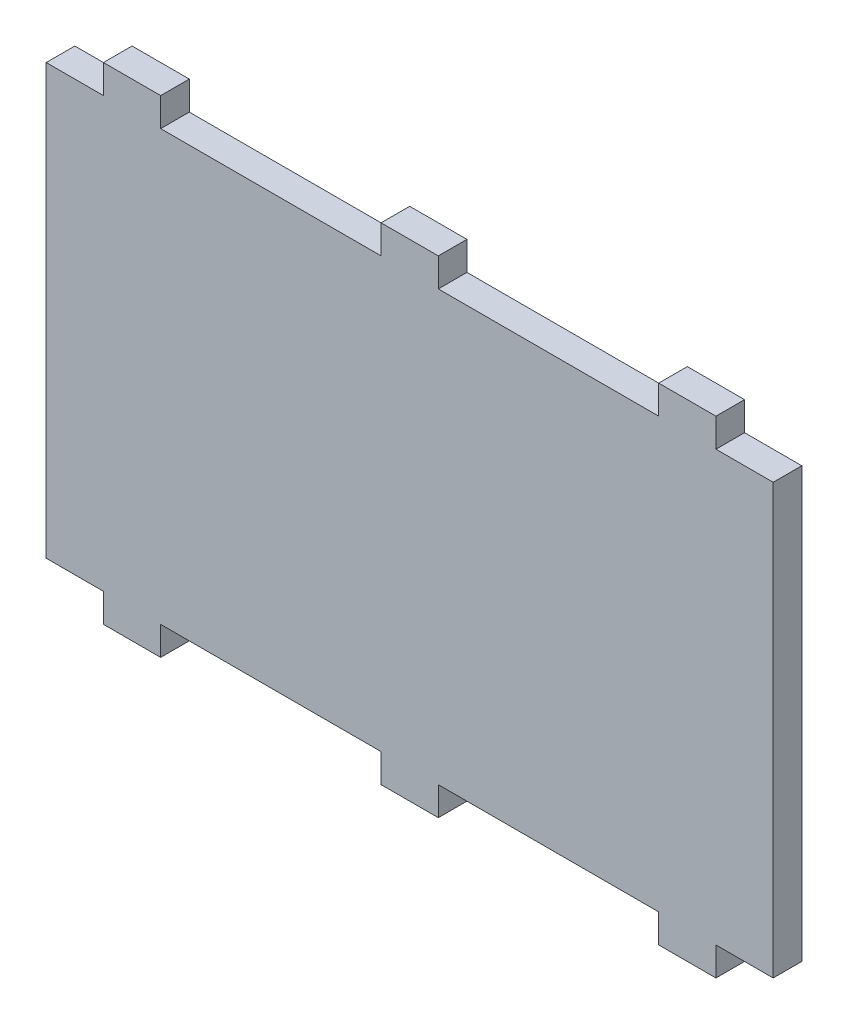
from build123d import *

# Parameters (mm, degrees)
ESQUISSE1_W        = 127
ESQUISSE1_H        = 75
BOSS_EXTRU_1_DEPTH = 5
ESQUISSE2_W        = 10
ESQUISSE2_H        = 5
BOSS_EXTRU_2_DEPTH = 5


with BuildPart() as part:
    # Esquisse1 → Boss.-Extru.1 (new body)
    with BuildSketch(Plane.XY):
        with Locations((63.5, 37.5)):
            Rectangle(ESQUISSE1_W, ESQUISSE1_H)
    extrude(amount=BOSS_EXTRU_1_DEPTH)

    # Esquisse2 → Boss.-Extru.2 (add)
    with BuildSketch(Plane.XY.offset(5)):
        with Locations((15, 77.5)):
            Rectangle(ESQUISSE2_W, ESQUISSE2_H)
        with Locations((112, 77.5)):
            Rectangle(ESQUISSE2_W, ESQUISSE2_H)
        with Locations((63.5, 77.5)):
            Rectangle(ESQUISSE2_W, ESQUISSE2_H)
        with Locations((15, -2.5)):
            Rectangle(ESQUISSE2_W, ESQUISSE2_H)
        with Locations((63.5, -2.5)):
            Rectangle(ESQUISSE2_W, ESQUISSE2_H)
        with Locations((112, -2.5)):
            Rectangle(ESQUISSE2_W, ESQUISSE2_H)
    extrude(amount=-BOSS_EXTRU_2_DEPTH)


solid = part.part
